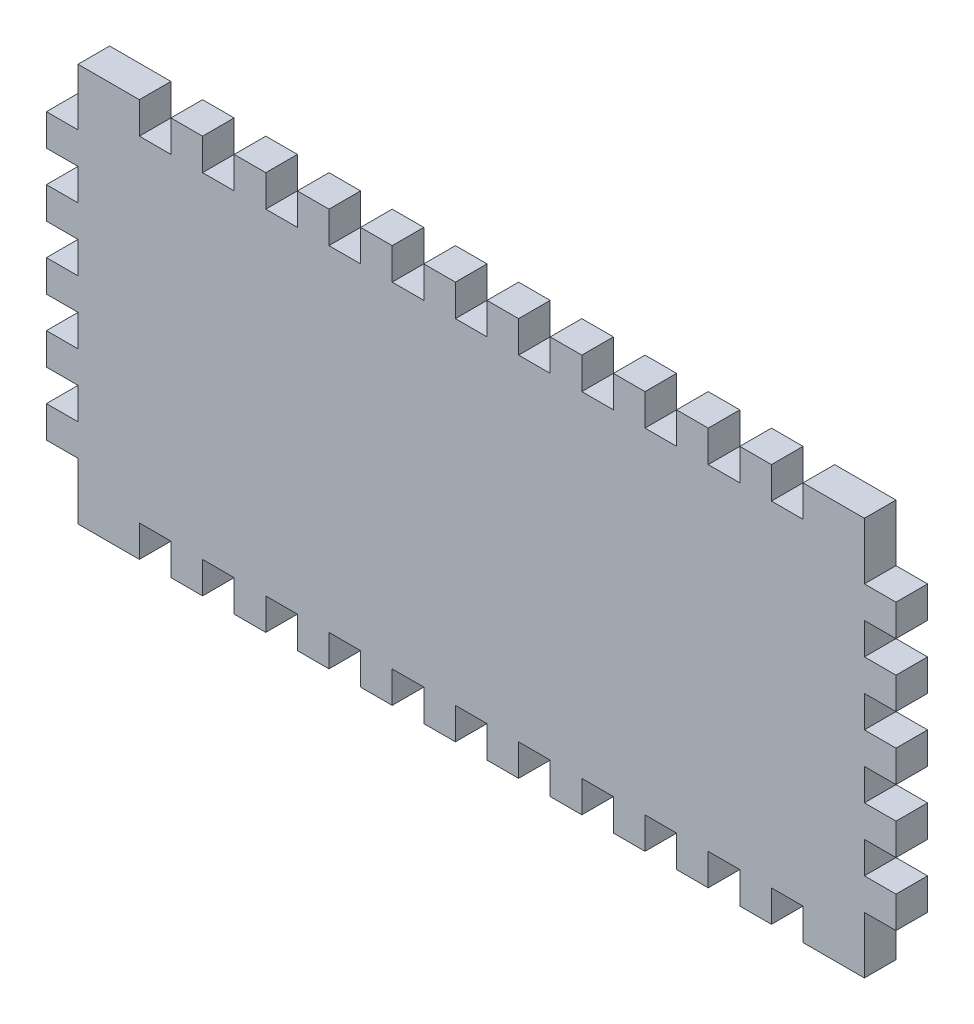
from build123d import *

# Parameters (mm, degrees)
SKETCH1_W                = 79
SKETCH1_H                = 40
BOSS_EXTRUDE1_DEPTH      = 3.175
SKETCH2_W                = 3.175
SKETCH2_H                = 6.35
CUT_EXTRUDE1_DEPTH       = 3.175
LPATTERN1_COUNT          = 6
LPATTERN1_PITCH          = 6.35
LPATTERN1_COL_COUNT      = 6
LPATTERN1_COL_PITCH      = 6.35
MIRROR1_COPY_1_SKETCH_W  = 3.175
MIRROR1_COPY_1_SKETCH_H  = 6.35
MIRROR1_COPY_1_DEPTH     = 3.175
MIRROR1_COPY_2_SKETCH_W  = 3.175
MIRROR1_COPY_2_SKETCH_H  = 6.35
MIRROR1_COPY_2_DEPTH     = 3.175
MIRROR1_COPY_3_SKETCH_W  = 3.175
MIRROR1_COPY_3_SKETCH_H  = 6.35
MIRROR1_COPY_3_DEPTH     = 3.175
MIRROR1_COPY_4_SKETCH_W  = 3.175
MIRROR1_COPY_4_SKETCH_H  = 6.35
MIRROR1_COPY_4_DEPTH     = 3.175
MIRROR1_COPY_5_SKETCH_W  = 3.175
MIRROR1_COPY_5_SKETCH_H  = 6.35
MIRROR1_COPY_5_DEPTH     = 3.175
MIRROR1_COPY_6_SKETCH_W  = 3.175
MIRROR1_COPY_6_SKETCH_H  = 6.35
MIRROR1_COPY_6_DEPTH     = 3.175
MIRROR1_COPY_7_SKETCH_W  = 3.175
MIRROR1_COPY_7_SKETCH_H  = 6.35
MIRROR1_COPY_7_DEPTH     = 3.175
MIRROR1_COPY_8_SKETCH_W  = 3.175
MIRROR1_COPY_8_SKETCH_H  = 6.35
MIRROR1_COPY_8_DEPTH     = 3.175
MIRROR1_COPY_9_SKETCH_W  = 3.175
MIRROR1_COPY_9_SKETCH_H  = 6.35
MIRROR1_COPY_9_DEPTH     = 3.175
MIRROR1_COPY_10_SKETCH_W = 3.175
MIRROR1_COPY_10_SKETCH_H = 6.35
MIRROR1_COPY_10_DEPTH    = 3.175
SKETCH3_W                = 6.35
SKETCH3_H                = 3.175
BOSS_EXTRUDE2_DEPTH      = 3.175
LPATTERN2_COUNT          = 3
LPATTERN2_PITCH          = 6.35
LPATTERN2_COL_COUNT      = 3
LPATTERN2_COL_PITCH      = 6.35
MIRROR2_COPY_1_SKETCH_W  = 6.35
MIRROR2_COPY_1_SKETCH_H  = 3.175
MIRROR2_COPY_1_DEPTH     = 3.175
MIRROR2_COPY_2_SKETCH_W  = 6.35
MIRROR2_COPY_2_SKETCH_H  = 3.175
MIRROR2_COPY_2_DEPTH     = 3.175
MIRROR2_COPY_3_SKETCH_W  = 6.35
MIRROR2_COPY_3_SKETCH_H  = 3.175
MIRROR2_COPY_3_DEPTH     = 3.175
MIRROR2_COPY_4_SKETCH_W  = 6.35
MIRROR2_COPY_4_SKETCH_H  = 3.175
MIRROR2_COPY_4_DEPTH     = 3.175


with BuildPart() as part:
    # Sketch1 → Boss-Extrude1 (new body)
    with BuildSketch(Plane.XY):
        Rectangle(SKETCH1_W, SKETCH1_H)
    extrude(amount=BOSS_EXTRUDE1_DEPTH)

    # Sketch2 → Cut-Extrude1 (cut)
    with BuildSketch(Plane.XY.offset(3.175)):
        with Locations((0, -20)):
            Rectangle(SKETCH2_W, SKETCH2_H)
    cut_extrude1 = extrude(amount=-CUT_EXTRUDE1_DEPTH, mode=Mode.SUBTRACT)

    # LPattern1: Cut-Extrude1 ×6
    with Locations(*[(i * LPATTERN1_PITCH, 0, 0) for i in range(1, LPATTERN1_COUNT)]):
        add(cut_extrude1, mode=Mode.SUBTRACT)

    # LPattern1 col: Cut-Extrude1 ×6
    with Locations(*[(-i * LPATTERN1_COL_PITCH, 0, 0) for i in range(1, LPATTERN1_COL_COUNT)]):
        add(cut_extrude1, mode=Mode.SUBTRACT)

    # Mirror1: Cut-Extrude1 across plane
    add(cut_extrude1.mirror(Plane.ZX), mode=Mode.SUBTRACT)

    # Mirror1 copy 1 sketch → Mirror1 copy 1 (cut)
    with BuildSketch(Plane(origin=(6.35, 0, 3.175), x_dir=(1, 0, 0), z_dir=(0, 0, 1))):
        with Locations((0, 20)):
            Rectangle(MIRROR1_COPY_1_SKETCH_W, MIRROR1_COPY_1_SKETCH_H)
    extrude(amount=-MIRROR1_COPY_1_DEPTH, mode=Mode.SUBTRACT)

    # Mirror1 copy 2 sketch → Mirror1 copy 2 (cut)
    with BuildSketch(Plane(origin=(12.7, 0, 3.175), x_dir=(1, 0, 0), z_dir=(0, 0, 1))):
        with Locations((0, 20)):
            Rectangle(MIRROR1_COPY_2_SKETCH_W, MIRROR1_COPY_2_SKETCH_H)
    extrude(amount=-MIRROR1_COPY_2_DEPTH, mode=Mode.SUBTRACT)

    # Mirror1 copy 3 sketch → Mirror1 copy 3 (cut)
    with BuildSketch(Plane(origin=(19.05, 0, 3.175), x_dir=(1, 0, 0), z_dir=(0, 0, 1))):
        with Locations((0, 20)):
            Rectangle(MIRROR1_COPY_3_SKETCH_W, MIRROR1_COPY_3_SKETCH_H)
    extrude(amount=-MIRROR1_COPY_3_DEPTH, mode=Mode.SUBTRACT)

    # Mirror1 copy 4 sketch → Mirror1 copy 4 (cut)
    with BuildSketch(Plane(origin=(25.4, 0, 3.175), x_dir=(1, 0, 0), z_dir=(0, 0, 1))):
        with Locations((0, 20)):
            Rectangle(MIRROR1_COPY_4_SKETCH_W, MIRROR1_COPY_4_SKETCH_H)
    extrude(amount=-MIRROR1_COPY_4_DEPTH, mode=Mode.SUBTRACT)

    # Mirror1 copy 5 sketch → Mirror1 copy 5 (cut)
    with BuildSketch(Plane(origin=(31.75, 0, 3.175), x_dir=(1, 0, 0), z_dir=(0, 0, 1))):
        with Locations((0, 20)):
            Rectangle(MIRROR1_COPY_5_SKETCH_W, MIRROR1_COPY_5_SKETCH_H)
    extrude(amount=-MIRROR1_COPY_5_DEPTH, mode=Mode.SUBTRACT)

    # Mirror1 copy 6 sketch → Mirror1 copy 6 (cut)
    with BuildSketch(Plane(origin=(-6.35, 0, 3.175), x_dir=(1, 0, 0), z_dir=(0, 0, 1))):
        with Locations((0, 20)):
            Rectangle(MIRROR1_COPY_6_SKETCH_W, MIRROR1_COPY_6_SKETCH_H)
    extrude(amount=-MIRROR1_COPY_6_DEPTH, mode=Mode.SUBTRACT)

    # Mirror1 copy 7 sketch → Mirror1 copy 7 (cut)
    with BuildSketch(Plane(origin=(-12.7, 0, 3.175), x_dir=(1, 0, 0), z_dir=(0, 0, 1))):
        with Locations((0, 20)):
            Rectangle(MIRROR1_COPY_7_SKETCH_W, MIRROR1_COPY_7_SKETCH_H)
    extrude(amount=-MIRROR1_COPY_7_DEPTH, mode=Mode.SUBTRACT)

    # Mirror1 copy 8 sketch → Mirror1 copy 8 (cut)
    with BuildSketch(Plane(origin=(-19.05, 0, 3.175), x_dir=(1, 0, 0), z_dir=(0, 0, 1))):
        with Locations((0, 20)):
            Rectangle(MIRROR1_COPY_8_SKETCH_W, MIRROR1_COPY_8_SKETCH_H)
    extrude(amount=-MIRROR1_COPY_8_DEPTH, mode=Mode.SUBTRACT)

    # Mirror1 copy 9 sketch → Mirror1 copy 9 (cut)
    with BuildSketch(Plane(origin=(-25.4, 0, 3.175), x_dir=(1, 0, 0), z_dir=(0, 0, 1))):
        with Locations((0, 20)):
            Rectangle(MIRROR1_COPY_9_SKETCH_W, MIRROR1_COPY_9_SKETCH_H)
    extrude(amount=-MIRROR1_COPY_9_DEPTH, mode=Mode.SUBTRACT)

    # Mirror1 copy 10 sketch → Mirror1 copy 10 (cut)
    with BuildSketch(Plane(origin=(-31.75, 0, 3.175), x_dir=(1, 0, 0), z_dir=(0, 0, 1))):
        with Locations((0, 20)):
            Rectangle(MIRROR1_COPY_10_SKETCH_W, MIRROR1_COPY_10_SKETCH_H)
    extrude(amount=-MIRROR1_COPY_10_DEPTH, mode=Mode.SUBTRACT)

    # Sketch3 → Boss-Extrude2 (add)
    with BuildSketch(Plane.XY.offset(3.175)):
        with Locations((-39.5, 0)):
            Rectangle(SKETCH3_W, SKETCH3_H)
    boss_extrude2 = extrude(amount=-BOSS_EXTRUDE2_DEPTH)

    # LPattern2: Boss-Extrude2 ×3
    with Locations(*[(0, i * LPATTERN2_PITCH, 0) for i in range(1, LPATTERN2_COUNT)]):
        add(boss_extrude2)

    # LPattern2 col: Boss-Extrude2 ×3
    with Locations(*[(0, -i * LPATTERN2_COL_PITCH, 0) for i in range(1, LPATTERN2_COL_COUNT)]):
        add(boss_extrude2)

    # Mirror2: Boss-Extrude2 across plane
    add(boss_extrude2.mirror(Plane(origin=(0, 0, 0), x_dir=(0, 0, 1), z_dir=(1, 0, 0))))

    # Mirror2 copy 1 sketch → Mirror2 copy 1 (add)
    with BuildSketch(Plane(origin=(0, 6.35, 3.175), x_dir=(-1, 0, 0), z_dir=(0, 0, 1))):
        with Locations((-39.5, 0)):
            Rectangle(MIRROR2_COPY_1_SKETCH_W, MIRROR2_COPY_1_SKETCH_H)
    extrude(amount=-MIRROR2_COPY_1_DEPTH)

    # Mirror2 copy 2 sketch → Mirror2 copy 2 (add)
    with BuildSketch(Plane(origin=(0, 12.7, 3.175), x_dir=(-1, 0, 0), z_dir=(0, 0, 1))):
        with Locations((-39.5, 0)):
            Rectangle(MIRROR2_COPY_2_SKETCH_W, MIRROR2_COPY_2_SKETCH_H)
    extrude(amount=-MIRROR2_COPY_2_DEPTH)

    # Mirror2 copy 3 sketch → Mirror2 copy 3 (add)
    with BuildSketch(Plane(origin=(0, -6.35, 3.175), x_dir=(-1, 0, 0), z_dir=(0, 0, 1))):
        with Locations((-39.5, 0)):
            Rectangle(MIRROR2_COPY_3_SKETCH_W, MIRROR2_COPY_3_SKETCH_H)
    extrude(amount=-MIRROR2_COPY_3_DEPTH)

    # Mirror2 copy 4 sketch → Mirror2 copy 4 (add)
    with BuildSketch(Plane(origin=(0, -12.7, 3.175), x_dir=(-1, 0, 0), z_dir=(0, 0, 1))):
        with Locations((-39.5, 0)):
            Rectangle(MIRROR2_COPY_4_SKETCH_W, MIRROR2_COPY_4_SKETCH_H)
    extrude(amount=-MIRROR2_COPY_4_DEPTH)


solid = part.part
